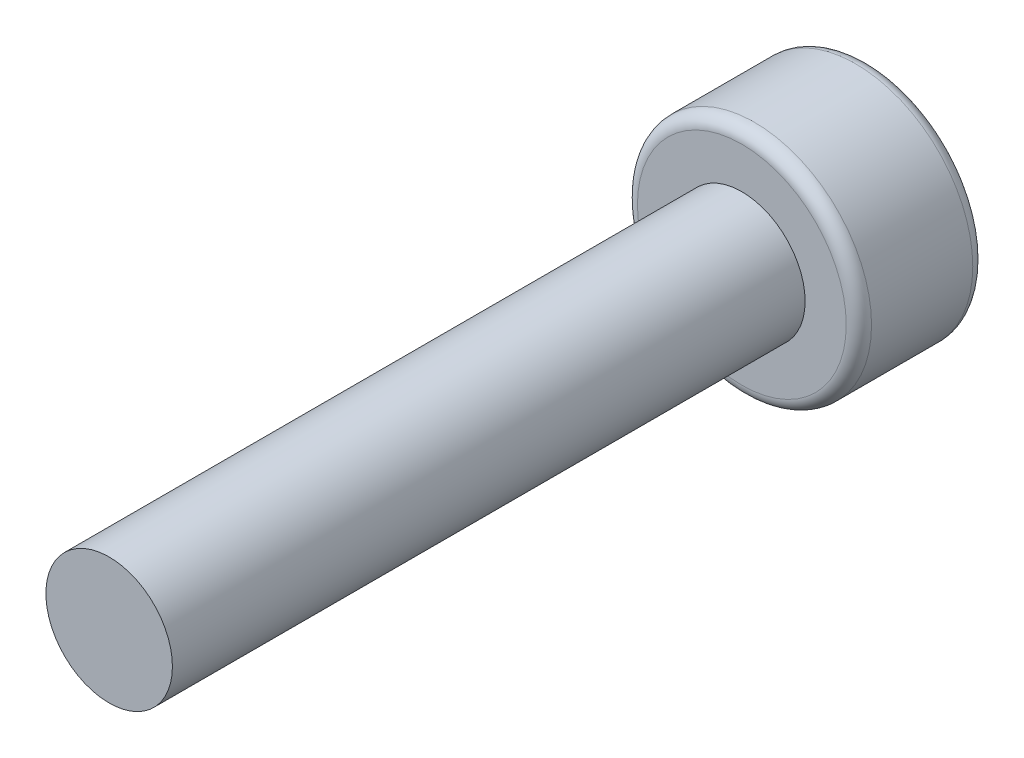
from build123d import *

# Parameters (mm, degrees)
SKETCH_1_R          = 1.85
EXTRUDE_1_DEPTH     = 2
SKETCH_2_R          = 1
EXTRUDE_2_DEPTH     = 10
FILLET_1_R          = 0.2
CUT_EXTRUDE_1_DEPTH = 1


with BuildPart() as part:
    # 草图1 → 凸台-拉伸1 (new body)
    with BuildSketch(Plane.XY):
        Circle(SKETCH_1_R)
    extrude(amount=EXTRUDE_1_DEPTH)

    # 草图2 → 凸台-拉伸2 (add)
    with BuildSketch(Plane.XY.offset(2)):
        Circle(SKETCH_2_R)
    extrude(amount=EXTRUDE_2_DEPTH)

    # 圆角1
    fillet_1_edges = [part.edges().sort_by_distance(p)[0] for p in [
        (-1.85, 0, 0),
        (-1.85, 0, 2),
    ]]
    fillet(fillet_1_edges, radius=FILLET_1_R)

    # 草图3 → 切除-拉伸1 (cut)
    with BuildSketch(Plane(origin=(0, 0, 0), x_dir=(-1, 0, 0), z_dir=(0, 0, -1))):
        Polygon((-0.380295932, 1.357083429), (-1.365416691, 0.349195776), (-0.985120759, -1.007887653), (0.380295932, -1.357083429), (1.365416691, -0.349195776), (0.985120759, 1.007887653), align=None)
    extrude(amount=-CUT_EXTRUDE_1_DEPTH, mode=Mode.SUBTRACT)


solid = part.part
